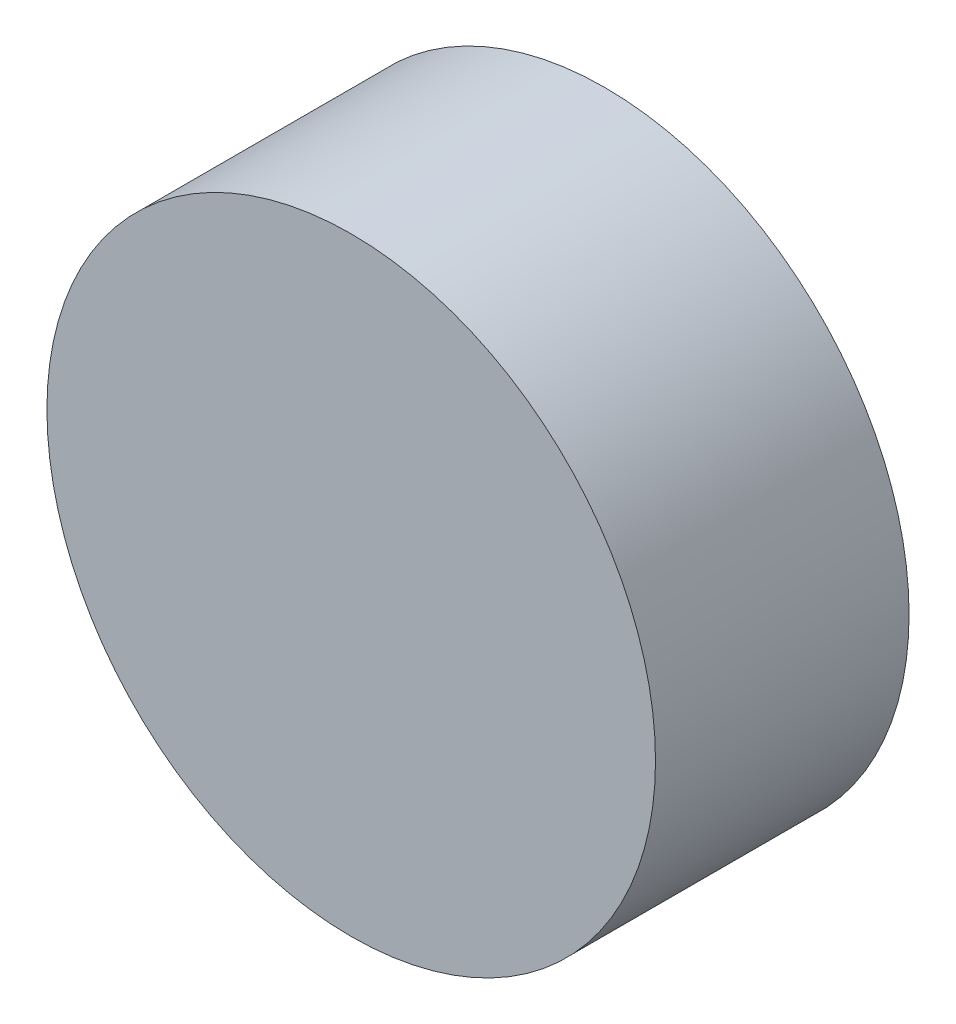
from build123d import *

# Parameters (mm, degrees)
SKETCH_1_R      = 3.6
EXTRUDE_1_DEPTH = 3


with BuildPart() as part:
    # 草圖1 → 填料-伸長1 (new body)
    with BuildSketch(Plane.XY):
        with Locations((6.300299999, 8.299876043)):
            Circle(SKETCH_1_R)
    extrude(amount=-EXTRUDE_1_DEPTH)


solid = part.part
